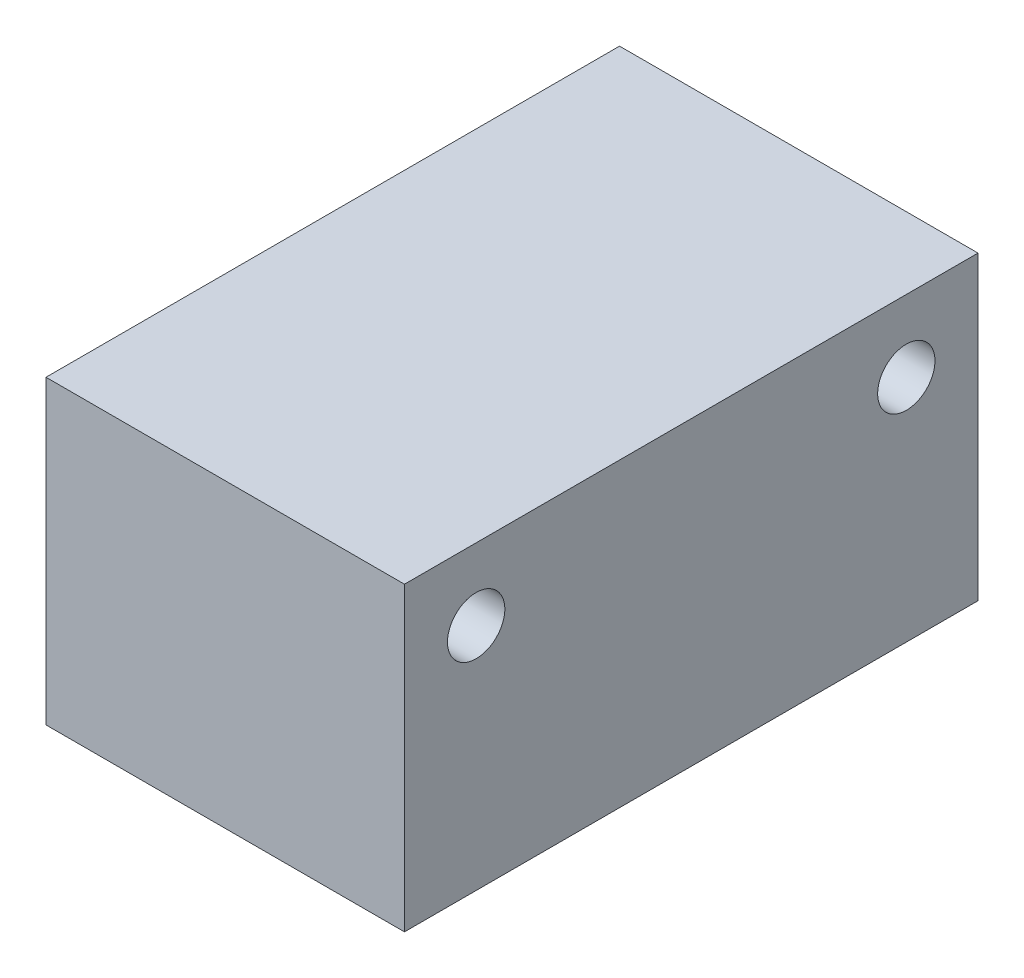
from build123d import *

# Parameters (mm, degrees)
SKETCH1_W           = 50
SKETCH1_H           = 80
BOSS_EXTRUDE1_DEPTH = 42
SKETCH2_W           = 35
SKETCH2_H           = 45
BOSS_EXTRUDE2_DEPTH = 5
SKETCH3_R           = 4
CUT_EXTRUDE1_DEPTH  = 77.576758876


with BuildPart() as part:
    # Sketch1 → Boss-Extrude1 (new body)
    with BuildSketch(Plane(origin=(0, 0, 0), x_dir=(1, 0, 0), z_dir=(0, 1, 0))):
        Rectangle(SKETCH1_W, SKETCH1_H)
    extrude(amount=BOSS_EXTRUDE1_DEPTH)

    # Sketch2 → Boss-Extrude2 (add)
    with BuildSketch(Plane.XZ):
        Rectangle(SKETCH2_W, SKETCH2_H)
    extrude(amount=BOSS_EXTRUDE2_DEPTH)

    # Sketch3 → Cut-Extrude1 (cut, through all)
    with BuildSketch(Plane.ZY.offset(25)):
        with Locations((-30, 32)):
            Circle(SKETCH3_R)
        with Locations((30, 32)):
            Circle(SKETCH3_R)
    extrude(amount=-CUT_EXTRUDE1_DEPTH, mode=Mode.SUBTRACT)


solid = part.part
